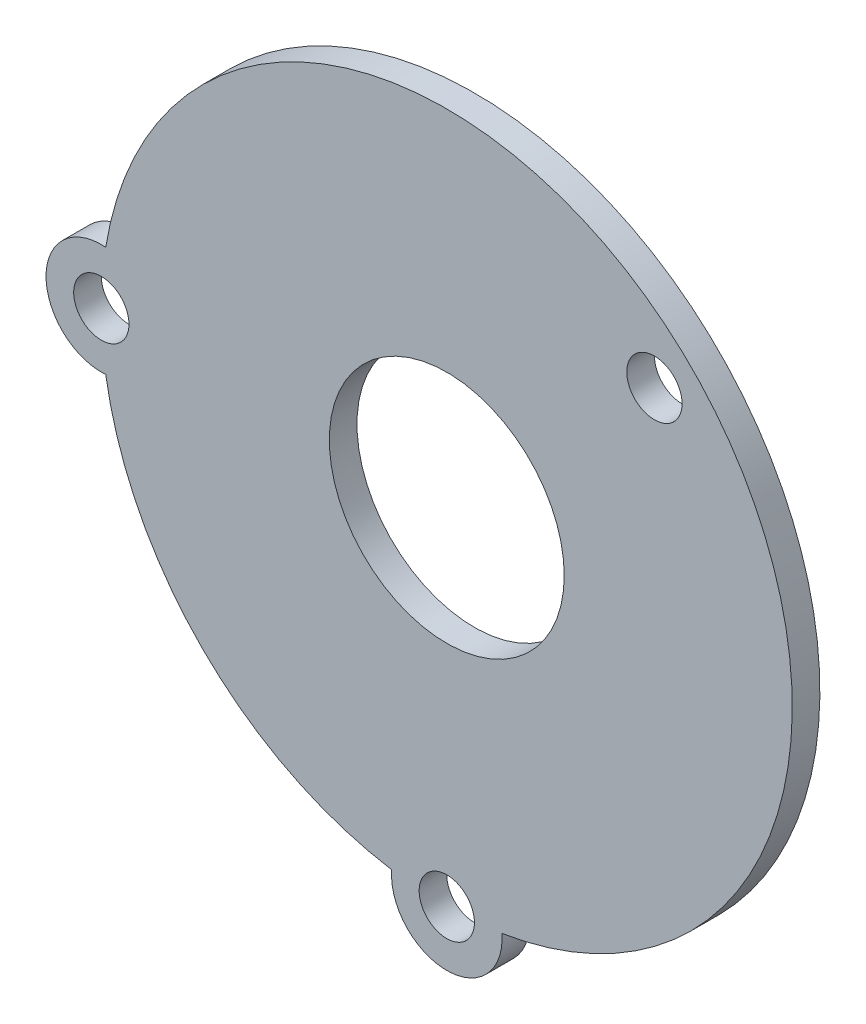
from build123d import *

# Parameters (mm, degrees)
SKETCH1_R           = 8.5
SKETCH1_R_2         = 2
BOSS_EXTRUDE1_DEPTH = 2


with BuildPart() as part:
    # Sketch1 → Boss-Extrude1 (new body)
    with BuildSketch(Plane.XY):
        with BuildLine():
            ThreePointArc((-15.03512775, 19.973605922), (-17.88515711, 17.467717514), (-20.323051095, 14.559312971))
            ThreePointArc((-20.323051095, 14.559312971), (-23.11408994, 9.525694004), (-24.68, 3.987179454))
            ThreePointArc((-24.68, 3.987179454), (-29, 0), (-24.68, -3.987179454))
            ThreePointArc((-24.68, -3.987179454), (-17.67766953, -17.67766953), (-3.987179454, -24.68))
            ThreePointArc((-3.987179454, -24.68), (0, -29), (3.987179454, -24.68))
            ThreePointArc((3.987179454, -24.68), (23.000009149, 9.797937495), (-15.03512775, 19.973605922))
        make_face()
        Circle(SKETCH1_R, mode=Mode.SUBTRACT)
        with Locations((0, -25)):
            Circle(SKETCH1_R_2, mode=Mode.SUBTRACT)
        with Locations((15.0260191, 15.0260191)):
            Circle(SKETCH1_R_2, mode=Mode.SUBTRACT)
        with Locations((-25, 0)):
            Circle(SKETCH1_R_2, mode=Mode.SUBTRACT)
    extrude(amount=BOSS_EXTRUDE1_DEPTH)


solid = part.part
